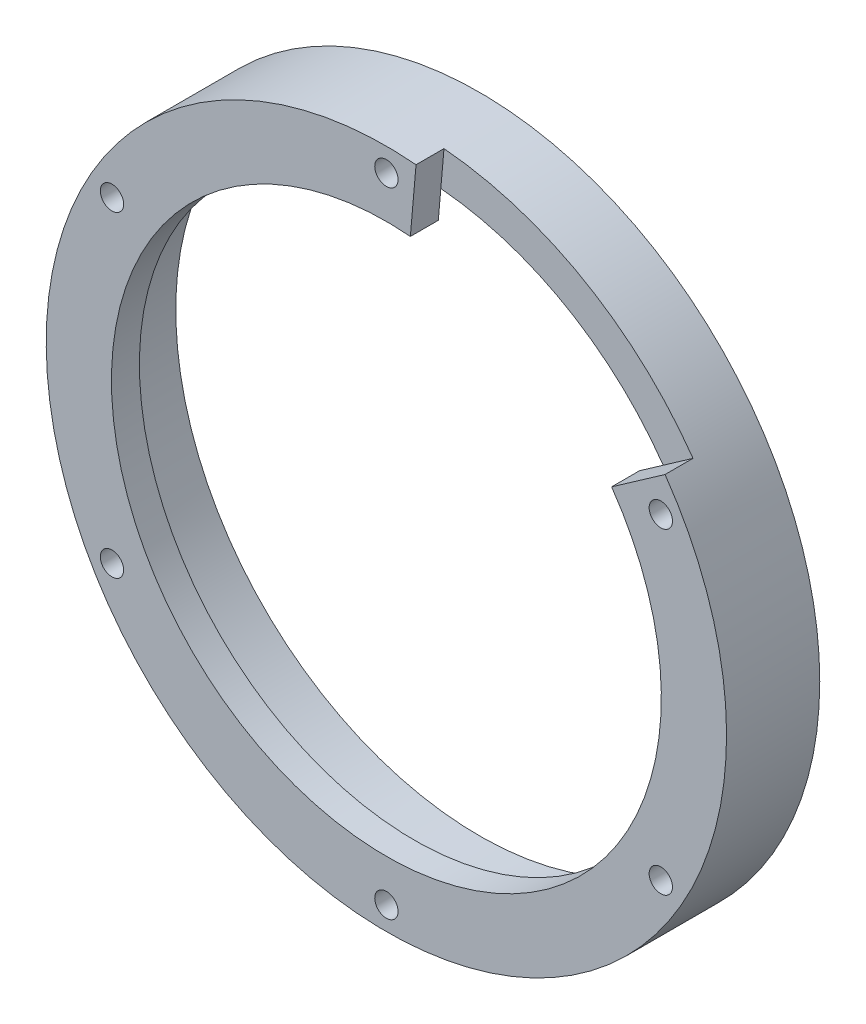
from build123d import *

# Parameters (mm, degrees)
SKETCH_1_R          = 36.5
SKETCH_1_R_2        = 32.6
EXTRUDE_1_DEPTH     = 3.5
EXTRUDE_START       = 3
SKETCH_2_R          = 36.5
SKETCH_2_R_2        = 29.5
EXTRUDE_2_DEPTH     = 3
SKETCH_3_R          = 1.25
CUT_EXTRUDE_1_DEPTH = 20
CUT_EXTRUDE_2_DEPTH = 3


with BuildPart() as part:
    # 草图1 → 凸台-拉伸1 (new, symmetric)
    with BuildSketch(Plane.XY):
        Circle(SKETCH_1_R)
        Circle(SKETCH_1_R_2, mode=Mode.SUBTRACT)
    extrude(amount=EXTRUDE_1_DEPTH, both=True)

    # 草图2 → 凸台-拉伸2 (add)
    with BuildSketch(Plane.XY.offset(3.5).offset(EXTRUDE_START)):
        Circle(SKETCH_2_R)
        Circle(SKETCH_2_R_2, mode=Mode.SUBTRACT)
    extrude(amount=-EXTRUDE_2_DEPTH)

    # 草图3 → 切除-拉伸1 (cut)
    with BuildSketch(Plane(origin=(0, 0, -3.5), x_dir=(-1, 0, 0), z_dir=(0, 0, -1))):
        with Locations((0, 34)):
            Circle(SKETCH_3_R)
        with Locations((29.444863729, 17)):
            Circle(SKETCH_3_R)
        with Locations((29.444863729, -17)):
            Circle(SKETCH_3_R)
        with Locations((0, -34)):
            Circle(SKETCH_3_R)
        with Locations((-29.444863729, -17)):
            Circle(SKETCH_3_R)
        with Locations((-29.444863729, 17)):
            Circle(SKETCH_3_R)
    extrude(amount=-CUT_EXTRUDE_1_DEPTH, mode=Mode.SUBTRACT)

    # 草图4 → 切除-拉伸2 (cut)
    with BuildSketch(Plane.XY.offset(6.5)):
        Polygon((19.356134005, 221.241624062), (3.18118461, 36.36110648), (0, 0), (29.899049617, 20.935539927), (181.922799809, 127.383715799), (367.509530933, 448.829363315), (204.942865129, 542.687271578), align=None)
    extrude(amount=-CUT_EXTRUDE_2_DEPTH, mode=Mode.SUBTRACT)


solid = part.part
